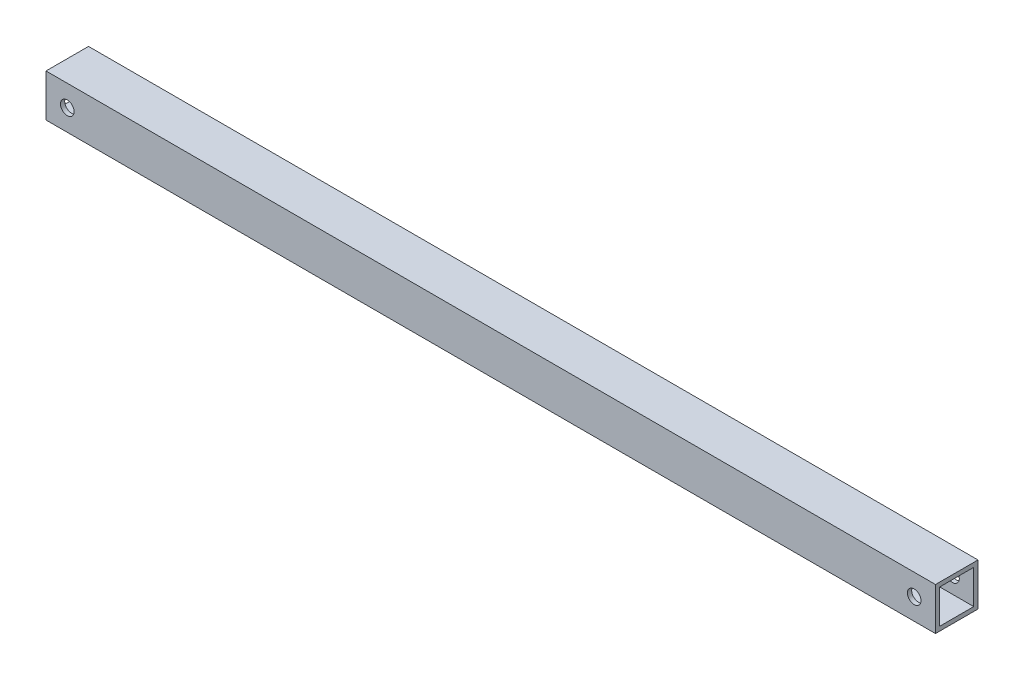
from build123d import *

# Parameters (mm, degrees)
SKETCH_1_W          = 209.185842875
SKETCH_1_H          = 10
SKETCH_1_R          = 1.6
EXTRUDE_1_DEPTH     = 10
SKETCH_2_W          = 8
SKETCH_2_H          = 8
CUT_EXTRUDE_1_DEPTH = 327.126841673


with BuildPart() as part:
    # ｽｹｯﾁ1 → ﾎﾞｽ - 押し出し1 (new body)
    with BuildSketch(Plane.XY):
        with Locations((-467.701812763, 245)):
            Rectangle(SKETCH_1_W, SKETCH_1_H)
        with Locations((-368.108891325, 245)):
            Circle(SKETCH_1_R, mode=Mode.SUBTRACT)
        with Locations((-567.2947342, 244.999999998)):
            Circle(SKETCH_1_R, mode=Mode.SUBTRACT)
    extrude(amount=EXTRUDE_1_DEPTH)

    # ｽｹｯﾁ2 → ｶｯﾄ - 押し出し1 (cut, through all)
    with BuildSketch(Plane.ZY.offset(572.2947342)):
        with Locations((5, 245)):
            Rectangle(SKETCH_2_W, SKETCH_2_H)
    extrude(amount=-CUT_EXTRUDE_1_DEPTH, mode=Mode.SUBTRACT)


solid = part.part
